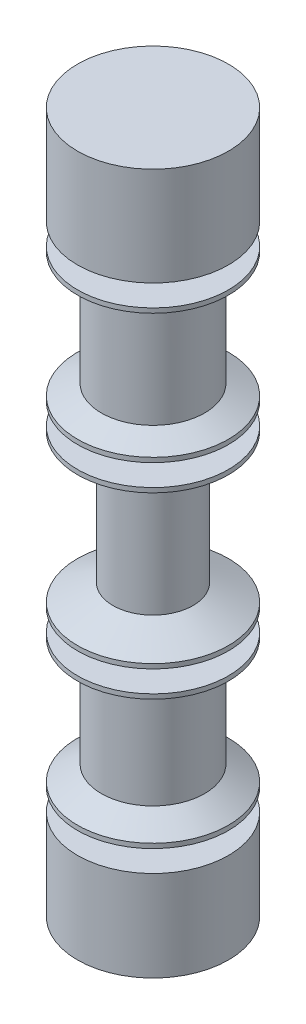
from build123d import *

# Parameters (mm, degrees)
MIDBODYS_R                           = 2.6
MIDBODY_DEPTH                        = 3.7
MIDORINGBODYS_R                      = 2.5
MIDORINGBODY_DEPTH                   = 1.4
EXTENDEDMIDBODYS_R                   = 3.35
EXTENDEDMIDBODY_DEPTH                = 6.4
ENDORINGBODYS_R                      = 2.5
ENDORINGBODY_DEPTH                   = 1.4
ENDBODY_START                        = 6.4
ENDBODYS_R                           = 4.9
ENDBODY_DEPTH                        = 6.4
F_4_2_4_2_DIAMETER_HOLE1_D           = 4.2
F_4_2_4_2_DIAMETER_HOLE1_DEPTH       = 9.4
F_4_2_4_2_DIAMETER_HOLE1_CSINK_D     = 5
F_4_2_4_2_DIAMETER_HOLE1_CSINK_ANGLE = 90
F_4_2_4_2_DIAMETER_HOLE1_TIP         = 1.2618073
CHAMFERS_OUTSIDE_W                   = 186.02
CHAMFERS_OUTSIDE_H                   = 186.02
CHAMFERS_OUTSIDE_R                   = 4
CHAMFER_2_DEPTH                      = 47.519028365
CHAMFER_2_DRAFT                      = -60


with BuildPart() as part:
    # MidBodyS → MidBody (new body)
    with BuildSketch(Plane(origin=(0, 0, 0), x_dir=(1, 0, 0), z_dir=(0, 1, 0))):
        with Locations(Location((0, 0, 0), (0, 0, 270))):
            Circle(MIDBODYS_R)
    midbody = extrude(amount=MIDBODY_DEPTH)

    # MidORingBaseS → MidORingBase (revolve)
    with BuildSketch(Plane.XY, mode=Mode.PRIVATE) as midoringbase_sk:
        Polygon((2.6, 3.7), (4.9, 4.8), (4.9, 5.1), (0, 5.1), (0, 3.7), align=None)
    midoringbase = revolve(midoringbase_sk.sketch.rotate(Axis((0, 5.1, 0), (0, -1, 0)), 180), axis=Axis((0, 5.1, 0), (0, -1, 0)))

    # MidORingBodyS → MidORingBody (add)
    with BuildSketch(Plane(origin=(0, 5.1, 0), x_dir=(1, 0, 0), z_dir=(0, 1, 0))):
        with Locations(Location((0, 0, 0), (0, 0, 180))):
            Circle(MIDORINGBODYS_R)
    midoringbody = extrude(amount=MIDORINGBODY_DEPTH)

    # MidORingTopBaseS → MidORingTopBase (revolve)
    with BuildSketch(Plane.XY, mode=Mode.PRIVATE) as midoringtopbase_sk:
        Polygon((0, 6.5), (4.9, 6.5), (4.9, 6.8), (3.35, 7.5), (0, 7.5), align=None)
    midoringtopbase = revolve(midoringtopbase_sk.sketch.rotate(Axis((0, 6.5, 0), (0, 1, 0)), 90), axis=Axis((0, 6.5, 0), (0, 1, 0)))

    # ExtendedMidBodyS → ExtendedMidBody (add)
    with BuildSketch(Plane(origin=(0, 7.5, 0), x_dir=(1, 0, 0), z_dir=(0, 1, 0))):
        with Locations(Location((0, 0, 0), (0, 0, 180))):
            Circle(EXTENDEDMIDBODYS_R)
    extendedmidbody = extrude(amount=EXTENDEDMIDBODY_DEPTH)

    # EndORingBaseS → EndORingBase (revolve)
    with BuildSketch(Plane.XY, mode=Mode.PRIVATE) as endoringbase_sk:
        Polygon((0, 15.2), (4.9, 15.2), (4.9, 14.9), (3.35, 13.9), (0, 13.9), align=None)
    endoringbase = revolve(endoringbase_sk.sketch.rotate(Axis((0, 13.9, 0), (0, 1, 0)), 90), axis=Axis((0, 13.9, 0), (0, 1, 0)))

    # EndORingBodyS → EndORingBody (add)
    with BuildSketch(Plane(origin=(0, 15.2, 0), x_dir=(1, 0, 0), z_dir=(0, 1, 0))):
        with Locations(Location((0, 0, 0), (0, 0, 180))):
            Circle(ENDORINGBODYS_R)
    endoringbody = extrude(amount=ENDORINGBODY_DEPTH)

    # EndBodyS → EndBody (add)
    with BuildSketch(Plane(origin=(0, 16.6, 0), x_dir=(1, 0, 0), z_dir=(0, 1, 0)).offset(ENDBODY_START)):
        with Locations(Location((0, 0, 0), (0, 0, 180))):
            Circle(ENDBODYS_R)
    endbody = extrude(amount=-ENDBODY_DEPTH)

    # HalfBodyVM: MidBody, MidORingBase, MidORingBody, MidORingTopBase, ExtendedMidBody, EndORingBase, EndORingBody, EndBody across plane
    add(midbody.mirror(Plane.ZX))
    add(midoringbase.mirror(Plane.ZX))
    add(midoringbody.mirror(Plane.ZX))
    add(midoringtopbase.mirror(Plane.ZX))
    add(extendedmidbody.mirror(Plane.ZX))
    add(endoringbase.mirror(Plane.ZX))
    add(endoringbody.mirror(Plane.ZX))
    add(endbody.mirror(Plane.ZX))

    # Ø4.2 (4.2) Diameter Hole1
    with Locations(Plane(origin=(0, -23, 0), x_dir=(-1, 0, 0), z_dir=(0, -1, 0))):
        with Locations((0, 0)):
            CounterSinkHole(F_4_2_4_2_DIAMETER_HOLE1_D / 2, F_4_2_4_2_DIAMETER_HOLE1_CSINK_D / 2, depth=F_4_2_4_2_DIAMETER_HOLE1_DEPTH, counter_sink_angle=F_4_2_4_2_DIAMETER_HOLE1_CSINK_ANGLE)
            with Locations((0, 0, -(F_4_2_4_2_DIAMETER_HOLE1_DEPTH + F_4_2_4_2_DIAMETER_HOLE1_TIP / 2))):  # 118° drill point
                Cone(0, F_4_2_4_2_DIAMETER_HOLE1_D / 2, F_4_2_4_2_DIAMETER_HOLE1_TIP, mode=Mode.SUBTRACT)


with BuildPart() as chamfer_2_tool:
    # ChamferS outside → Chamfer 2 (with draft: the straight prism first)
    with BuildSketch(Plane.XZ.offset(23)):
        Rectangle(CHAMFERS_OUTSIDE_W, CHAMFERS_OUTSIDE_H)
        Circle(CHAMFERS_OUTSIDE_R, mode=Mode.SUBTRACT)
    extrude(amount=-CHAMFER_2_DEPTH)
    # Chamfer 2: the draft: its side faces are tilted about the plane it starts from
    chamfer_2_sides = [chamfer_2_tool.faces().sort_by_distance(p)[0] for p in [
        (0, 0.759514182, -93.01),
        (93.01, 0.759514182, 0),
        (0, 0.759514182, 93.01),
        (-93.01, 0.759514182, 0),
        (-4, 0.759514182, 0),
    ]]
    draft(chamfer_2_sides, Plane.XZ.offset(23), CHAMFER_2_DRAFT)


with BuildPart() as part_1:
    add(part.part)

    # Chamfer 2: cut by chamfer_2_tool
    add(chamfer_2_tool.part, mode=Mode.SUBTRACT)


solid = part_1.part
